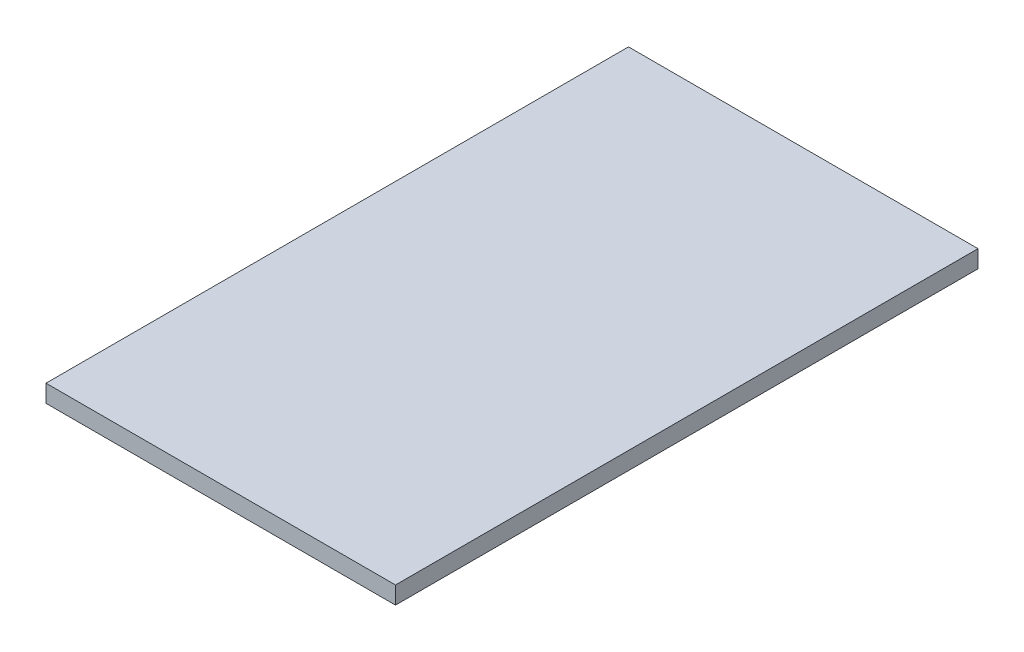
from build123d import *

# Parameters (mm, degrees)
SKETCH8_W            = 600
SKETCH8_H            = 1000
BOSS_EXTRUDE9_DEPTH  = 30
SKETCH11_R           = 10
SKETCH11_R_2         = 5
BOSS_EXTRUDE12_DEPTH = 10
SKETCH12_R           = 10
BOSS_EXTRUDE13_DEPTH = 10


with BuildPart() as part:
    # Sketch8 → Boss-Extrude9 (new body)
    with BuildSketch(Plane(origin=(0, 0, 0), x_dir=(1, 0, 0), z_dir=(0, 1, 0))):
        Rectangle(SKETCH8_W, SKETCH8_H)
    extrude(amount=BOSS_EXTRUDE9_DEPTH)

    # Sketch11 → Boss-Extrude12 (add)
    with BuildSketch(Plane(origin=(0, 0, 0), x_dir=(1, 0, 0), z_dir=(0, 1, 0))):
        Circle(SKETCH11_R)
        Circle(SKETCH11_R_2, mode=Mode.SUBTRACT)
    extrude(amount=BOSS_EXTRUDE12_DEPTH)

    # Sketch12 → Boss-Extrude13 (add)
    with BuildSketch(Plane(origin=(0, 0, 0), x_dir=(-1, 0, 0), z_dir=(0, -1, 0))):
        with Locations(Location((0, 0, 0), (0, 0, 270))):
            Circle(SKETCH12_R)
    extrude(amount=BOSS_EXTRUDE13_DEPTH)


solid = part.part
